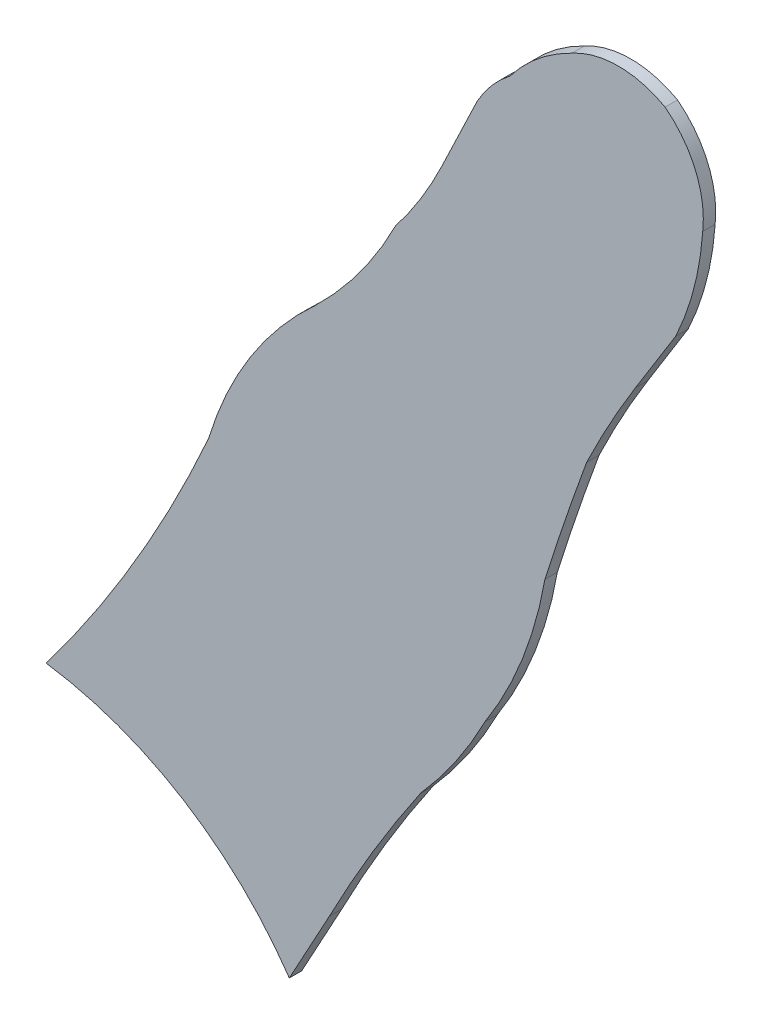
from build123d import *

# Parameters (mm, degrees)
BOSS_EXTRUDE3_DEPTH = 10


with BuildPart() as part:
    # Sketch1 → Boss-Extrude3 (new body)
    with BuildSketch(Plane.XY):
        with BuildLine():
            Line((61.719673081, 1004.040138522), (90.121595591, 1063.443540058))
            ThreePointArc((90.121595591, 1063.443540058), (101.806598129, 1080.290626418), (116.685466786, 1094.39675525))
            ThreePointArc((116.685466786, 1094.39675525), (139.054779467, 1117.668267819), (166.244818626, 1135.065141607))
            ThreePointArc((166.244818626, 1135.065141607), (203.849887916, 1144.889885631), (241.454957205, 1135.065141607))
            ThreePointArc((241.454957205, 1135.065141607), (265.935060661, 1103.204515558), (271.717774961, 1063.443540058))
            ThreePointArc((271.717774961, 1063.443540058), (264.746706267, 1020.532699182), (249.993176003, 979.639308419))
            Line((249.993176003, 979.639308419), (217.557058689, 927.454623329))
            ThreePointArc((217.557058689, 927.454623329), (196.913476553, 892.129764254), (178.225545137, 855.732451558))
            ThreePointArc((178.225545137, 855.732451558), (160.866603962, 806.767718632), (144.678077696, 757.403667679))
            ThreePointArc((144.678077696, 757.403667679), (126.716261258, 693.277809244), (96.398038564, 633.985668597))
            ThreePointArc((96.398038564, 633.985668597), (72.892497642, 594.596356166), (44.675436223, 558.432481475))
            ThreePointArc((44.675436223, 558.432481475), (6.069688965, 498.228600511), (-28.843305621, 435.810703931))
            Line((-28.843305621, 435.810703931), (-61.080316316, 376.666682759))
            ThreePointArc((-61.080316316, 376.666682759), (-146.105172251, 458.069534428), (-256.734722378, 498.278401925))
            ThreePointArc((-256.734722378, 498.278401925), (-185.027496066, 605.596315922), (-126.015280279, 720.385772571))
            ThreePointArc((-126.015280279, 720.385772571), (-92.438560876, 793.893867743), (-40.411397842, 855.732451558))
            ThreePointArc((-40.411397842, 855.732451558), (-4.339376244, 896.978618456), (24.369918596, 943.649952439))
            ThreePointArc((24.369918596, 943.649952439), (44.675436223, 972.836536947), (61.719673081, 1004.040138522))
        make_face()
    extrude(amount=BOSS_EXTRUDE3_DEPTH)


solid = part.part
